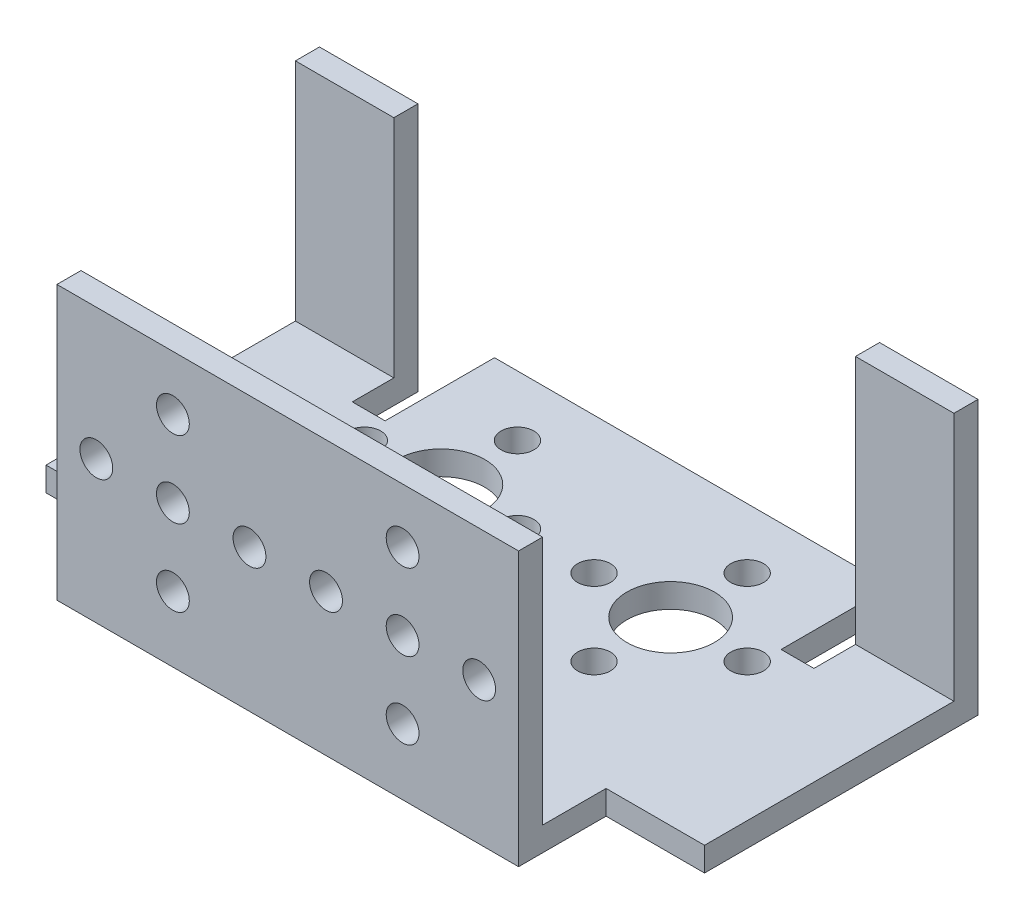
from build123d import *

# Parameters (mm, degrees)
BOSS_EXTRUDE1_DEPTH = 2.2
SKETCH2_W           = 9
SKETCH2_H           = 2.2
SKETCH2_W_2         = 42.2
BOSS_EXTRUDE2_DEPTH = 22.8
SKETCH3_W           = 9
SKETCH3_H           = 2.2
CUT_EXTRUDE1_DEPTH  = 50.796084183
SKETCH4_R           = 1.5
CUT_EXTRUDE2_DEPTH  = 54.851740919
SKETCH5_R           = 4
SKETCH5_R_2         = 1.5
CUT_EXTRUDE3_DEPTH  = 53.866340899


with BuildPart() as part:
    # Sketch1 → Boss-Extrude1 (new body)
    with BuildSketch(Plane(origin=(0, 0, 0), x_dir=(1, 0, 0), z_dir=(0, 1, 0))):
        Polygon((21.1, 0), (-21.1, 0), (-21.1, 8), (-30.1, 8), (-30.1, 33), (-21.1, 33), (-21.1, 27), (-18.1, 27), (-18.1, 37), (18.1, 37), (18.1, 27), (21.1, 27), (21.1, 33), (30.1, 33), (30.1, 8), (21.1, 8), align=None)
    extrude(amount=BOSS_EXTRUDE1_DEPTH)

    # Sketch2 → Boss-Extrude2 (add)
    with BuildSketch(Plane(origin=(0, 2.2, 0), x_dir=(1, 0, 0), z_dir=(0, 1, 0))):
        with Locations((25.6, 31.9)):
            Rectangle(SKETCH2_W, SKETCH2_H)
        with Locations((-25.6, 31.9)):
            Rectangle(SKETCH2_W, SKETCH2_H)
        with Locations((0, 1.1)):
            Rectangle(SKETCH2_W_2, SKETCH2_H)
    extrude(amount=BOSS_EXTRUDE2_DEPTH)

    # Sketch3 → Cut-Extrude1 (cut, through all)
    with BuildSketch(Plane.XY.offset(-30.8)):
        with Locations((-25.6, 23.9)):
            Rectangle(SKETCH3_W, SKETCH3_H)
    extrude(amount=-CUT_EXTRUDE1_DEPTH, mode=Mode.SUBTRACT)

    # Sketch4 → Cut-Extrude2 (cut, through all)
    with BuildSketch(Plane.XY):
        with Locations((-17.5, 13)):
            Circle(SKETCH4_R)
        with Locations((-10.5, 13)):
            Circle(SKETCH4_R)
        with Locations((-10.5, 20)):
            Circle(SKETCH4_R)
        with Locations((-3.5, 13)):
            Circle(SKETCH4_R)
        with Locations((-10.5, 6)):
            Circle(SKETCH4_R)
        with Locations((10.5, 6)):
            Circle(SKETCH4_R)
        with Locations((3.5, 13)):
            Circle(SKETCH4_R)
        with Locations((10.5, 20)):
            Circle(SKETCH4_R)
        with Locations((10.5, 13)):
            Circle(SKETCH4_R)
        with Locations((17.5, 13)):
            Circle(SKETCH4_R)
    extrude(amount=-CUT_EXTRUDE2_DEPTH, mode=Mode.SUBTRACT)

    # Sketch5 → Cut-Extrude3 (cut, through all)
    with BuildSketch(Plane(origin=(0, 2.2, 0), x_dir=(1, 0, 0), z_dir=(0, 1, 0))):
        with Locations(Location((-10.5, 24.5, 0), (0, 0, 270))):
            Circle(SKETCH5_R)
        with Locations(Location((-17.5, 24.5, 0), (0, 0, 270))):
            Circle(SKETCH5_R_2)
        with Locations(Location((-10.5, 31.5, 0), (0, 0, 270))):
            Circle(SKETCH5_R_2)
        with Locations(Location((-3.5, 24.5, 0), (0, 0, 270))):
            Circle(SKETCH5_R_2)
        with Locations(Location((-10.5, 17.5, 0), (0, 0, 270))):
            Circle(SKETCH5_R_2)
        with Locations(Location((10.5, 17.5, 0), (0, 0, 90))):
            Circle(SKETCH5_R_2)
        with Locations(Location((3.5, 24.5, 0), (0, 0, 90))):
            Circle(SKETCH5_R_2)
        with Locations(Location((10.5, 31.5, 0), (0, 0, 90))):
            Circle(SKETCH5_R_2)
        with Locations(Location((17.5, 24.5, 0), (0, 0, 90))):
            Circle(SKETCH5_R_2)
        with Locations(Location((10.5, 24.5, 0), (0, 0, 90))):
            Circle(SKETCH5_R)
    extrude(amount=-CUT_EXTRUDE3_DEPTH, mode=Mode.SUBTRACT)


solid = part.part
